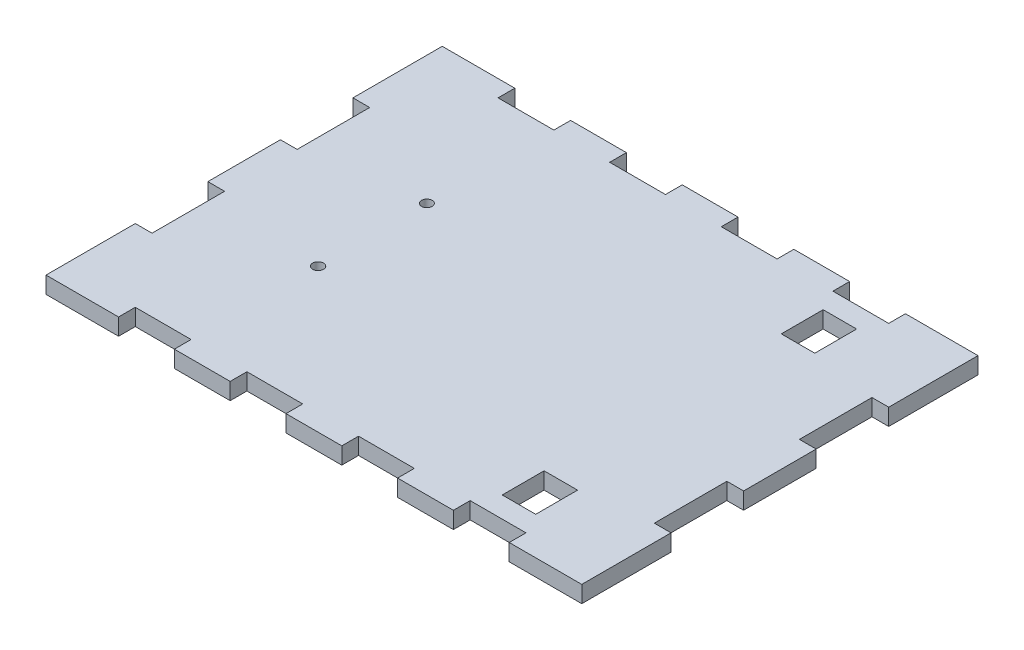
from build123d import *

# Parameters (mm, degrees)
SKETCH2_R           = 1.9
SKETCH2_R_2         = 1.95
SKETCH2_W           = 12
SKETCH2_H           = 15
BOSS_EXTRUDE2_DEPTH = 6


with BuildPart() as part:
    # Sketch2 → Boss-Extrude2 (new body)
    with BuildSketch(Plane(origin=(0, 0, 0), x_dir=(1, 0, 0), z_dir=(0, 1, 0))):
        Polygon((203.50455835, 73.988552732), (223.50455835, 73.988552732), (223.50455835, 67.988552732), (243.50455835, 67.988552732), (243.50455835, 73.988552732), (263.50455835, 73.988552732), (263.50455835, 67.988552732), (283.50455835, 67.988552732), (283.50455835, 73.988552732), (309.50455835, 73.988552732), (309.50455835, 41.988552732), (303.50455835, 41.988552732), (303.50455835, 15.988552732), (309.50455835, 15.988552732), (309.50455835, -10.011447268), (303.50455835, -10.011447268), (303.50455835, -36.011447268), (309.50455835, -36.011447268), (309.50455835, -68.011447268), (283.50455835, -68.011447268), (283.50455835, -62.011447268), (263.50455835, -62.011447268), (263.50455835, -68.011447268), (243.50455835, -68.011447268), (243.50455835, -62.011447268), (223.50455835, -62.011447268), (223.50455835, -68.011447268), (203.50455835, -68.011447268), (203.50455835, -62.011447268), (183.50455835, -62.011447268), (183.50455835, -68.011447268), (163.50455835, -68.011447268), (163.50455835, -62.011447268), (143.50455835, -62.011447268), (143.50455835, -68.011447268), (117.50455835, -68.011447268), (117.50455835, -36.011447268), (123.50455835, -36.011447268), (123.50455835, -10.011447268), (117.50455835, -10.011447268), (117.50455835, 15.988552732), (123.50455835, 15.988552732), (123.50455835, 41.988552732), (117.50455835, 41.988552732), (117.50455835, 73.988552732), (143.50455835, 73.988552732), (143.50455835, 67.988552732), (163.50455835, 67.988552732), (163.50455835, 73.988552732), (183.50455835, 73.988552732), (183.50455835, 67.988552732), (203.50455835, 67.988552732), align=None)
        with Locations(Location((163.50455835, 22.488552732, 0), (0, 0, 270))):
            Circle(SKETCH2_R, mode=Mode.SUBTRACT)
        with Locations(Location((163.50455835, -16.511447268, 0), (0, 0, 270))):
            Circle(SKETCH2_R_2, mode=Mode.SUBTRACT)
        with Locations((273.50455835, -47.011447268)):
            Rectangle(SKETCH2_W, SKETCH2_H, mode=Mode.SUBTRACT)
        with Locations((273.50455835, 52.988552732)):
            Rectangle(SKETCH2_W, SKETCH2_H, mode=Mode.SUBTRACT)
    extrude(amount=BOSS_EXTRUDE2_DEPTH)


solid = part.part
